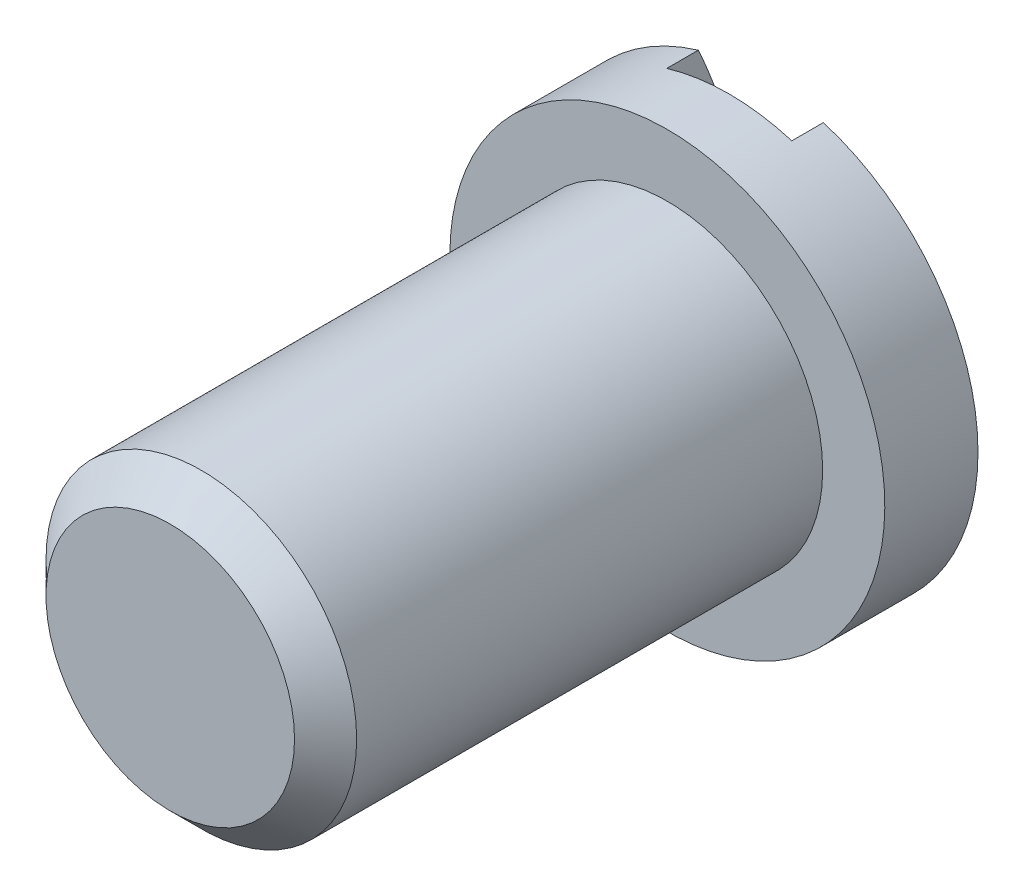
from build123d import *

# Parameters (mm, degrees)
SKETCH_1_R          = 2.5
EXTRUDE_1_DEPTH     = 8
CHAMFER_2_SIZE      = 0.5
SKETCH_2_R          = 3.5
EXTRUDE_2_DEPTH     = 1.5
DOME_1_FACE_RADIUS  = 3.5
DOME_1_HEIGHT       = 0.8
SKETCH_3_W          = 2.012887991
SKETCH_3_H          = 3.133753739
CUT_EXTRUDE_1_DEPTH = 5


with BuildPart() as part:
    # 草图1 → 凸台-拉伸1 (new body)
    with BuildSketch(Plane.XY):
        Circle(SKETCH_1_R)
    extrude(amount=EXTRUDE_1_DEPTH)

    # 倒角2
    chamfer_2_edges = [part.edges().sort_by_distance(p)[0] for p in [
        (-2.5, 0, 8),
    ]]
    chamfer(chamfer_2_edges, length=CHAMFER_2_SIZE)

    # 草图2 → 凸台-拉伸2 (add)
    with BuildSketch(Plane(origin=(0, 0, 0), x_dir=(-1, 0, 0), z_dir=(0, 0, -1))):
        Circle(SKETCH_2_R)
    extrude(amount=EXTRUDE_2_DEPTH)

    # 圆顶1: a dome of height H over a round flat face of radius A is a cap of a sphere of radius (A * A + H * H) / (2 * H)
    dome_1_r = (DOME_1_FACE_RADIUS * DOME_1_FACE_RADIUS + DOME_1_HEIGHT * DOME_1_HEIGHT) / (2 * DOME_1_HEIGHT)
    dome_1_base = Plane((0, 0, -1.5), z_dir=(0, 0, -1))
    with Locations(dome_1_base.offset(DOME_1_HEIGHT - dome_1_r)):
        dome_1_ball = Sphere(dome_1_r, mode=Mode.PRIVATE)
    add(split(dome_1_ball, bisect_by=dome_1_base, keep=Keep.TOP, mode=Mode.PRIVATE))

    # 草图3 → 切除-拉伸1 (cut, symmetric)
    with BuildSketch(Plane(origin=(0, 0, 0), x_dir=(1, 0, 0), z_dir=(0, 1, 0))):
        with Locations((0.004540496, 2.559156118)):
            Rectangle(SKETCH_3_W, SKETCH_3_H)
    extrude(amount=CUT_EXTRUDE_1_DEPTH, both=True, mode=Mode.SUBTRACT)


solid = part.part
